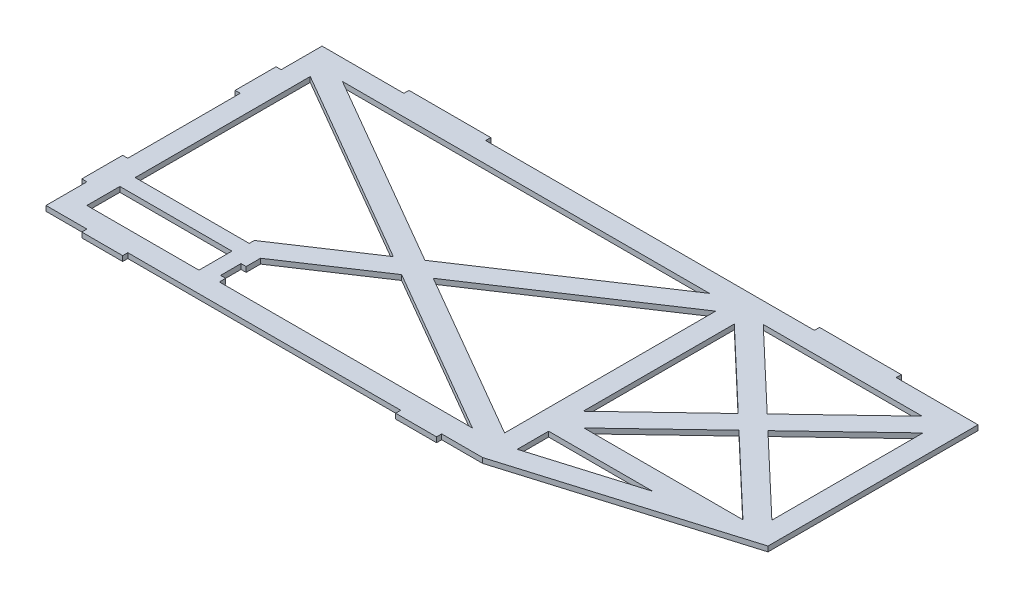
from build123d import *

# Parameters (mm, degrees)
SKETCH1_W           = 69.596
SKETCH1_H           = 20.4724
BOSS_EXTRUDE1_DEPTH = 3.175


with BuildPart() as part:
    # Sketch1 → Boss-Extrude1 (new body)
    with BuildSketch(Plane(origin=(0, 0, 0), x_dir=(1, 0, 0), z_dir=(0, 1, 0))):
        Polygon((135.5725, -85.725), (271.8181, -44.704), (271.8181, 85.725), (221.0181, 85.725), (221.0181, 88.9), (170.2181, 88.9), (170.2181, 85.725), (135.5725, 85.725), (-33.9725, 85.725), (-33.9725, 88.9), (-84.7725, 88.9), (-84.7725, 85.725), (-135.5725, 85.725), (-135.5725, 60.325), (-138.7475, 60.325), (-138.7475, 34.925), (-135.5725, 34.925), (-135.5725, -34.925), (-138.7475, -34.925), (-138.7475, -60.325), (-135.5725, -60.325), (-135.5725, -85.725), (-110.1725, -85.725), (-110.1725, -88.9), (-84.7725, -88.9), (-84.7725, -85.725), (84.7725, -85.725), (84.7725, -88.9), (110.1725, -88.9), (110.1725, -85.725), align=None)
        Polygon((191.30257064, 17.3355), (141.9225, -29.593760892), (141.9225, 64.264760892), align=None, mode=Mode.SUBTRACT)
        Polygon((209.73802936, 17.3355), (259.1181, -29.593760892), (259.1181, 64.264760892), align=None, mode=Mode.SUBTRACT)
        Polygon((141.9225, -51.054), (141.9225, -70.549992123), (206.675751855, -51.054), align=None, mode=Mode.SUBTRACT)
        Polygon((-40.5765, -56.4388), (-40.5765, -47.477682668), (12.060198108, -12.486286049), (116.555282623, -73.025), (-40.5765, -73.025), (-40.5765, -69.1388), (-43.7515, -69.1388), (-43.7515, -56.4388), align=None, mode=Mode.SUBTRACT)
        Polygon((-110.205282623, 73.025), (117.75227551, 73.025), (11.599803294, 2.457821761), align=None, mode=Mode.SUBTRACT)
        Polygon((-122.8725, 65.686309832), (-122.8725, -43.0276), (-52.04672449, -43.0276), (-52.04672449, -39.8526), (-0.197624716, -5.384776605), align=None, mode=Mode.SUBTRACT)
        with Locations((-88.0745, -62.7888)):
            Rectangle(SKETCH1_W, SKETCH1_H, mode=Mode.SUBTRACT)
        Polygon((129.2225, 65.399917332), (129.2225, -65.686309832), (23.857626118, -4.643687684), align=None, mode=Mode.SUBTRACT)
        Polygon((151.14022936, 73.025), (249.90037064, 73.025), (200.5203, 26.095739108), align=None, mode=Mode.SUBTRACT)
        Polygon((151.14022936, -38.354), (249.90037064, -38.354), (200.5203, 8.575260892), align=None, mode=Mode.SUBTRACT)
    extrude(amount=BOSS_EXTRUDE1_DEPTH)


solid = part.part
